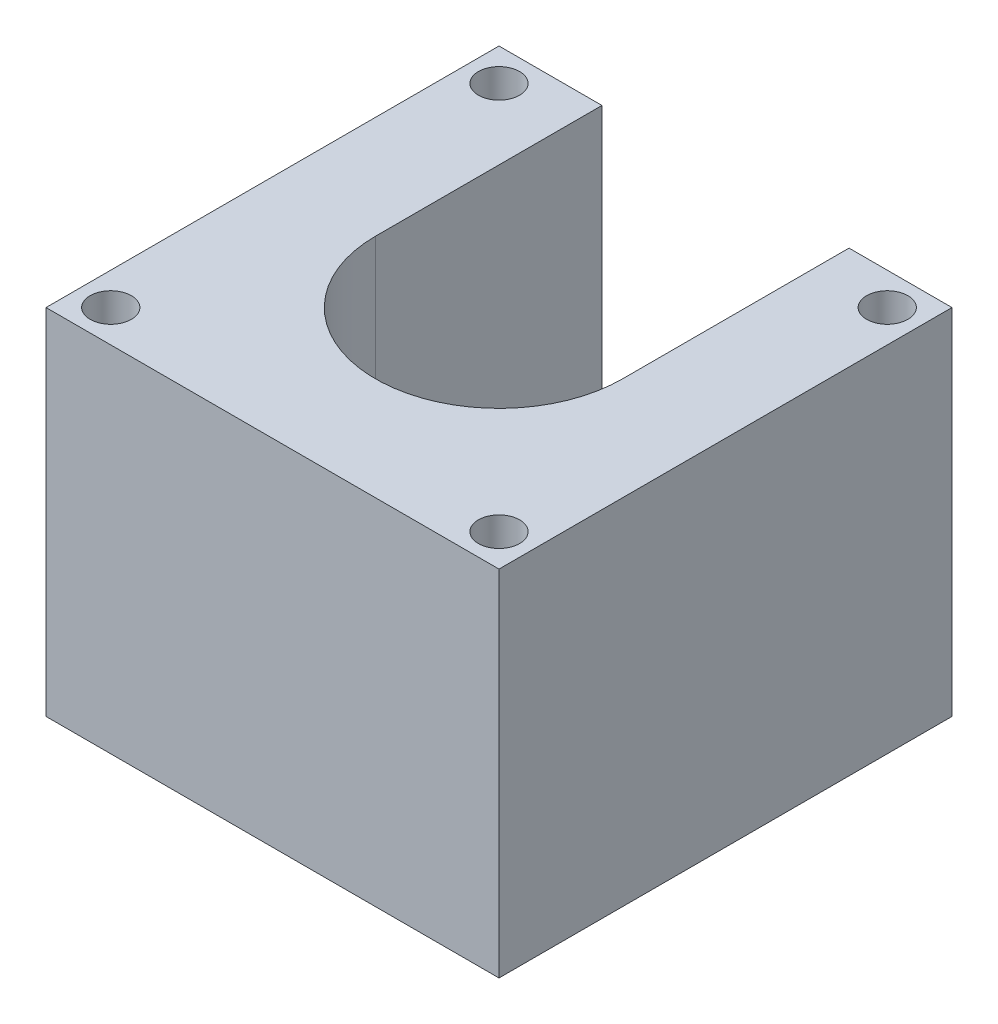
from build123d import *

# Parameters (mm, degrees)
SKETCH1_W           = 55
SKETCH1_H           = 55
SKETCH1_R           = 15
BOSS_EXTRUDE3_DEPTH = 9
BOSS_EXTRUDE4_DEPTH = 34
CUT_EXTRUDE1_REACH  = 60.644
SKETCH6_R           = 2.5


with BuildPart() as part:
    # Sketch1 → Boss-Extrude3 (new body)
    with BuildSketch(Plane(origin=(0, 0, 0), x_dir=(1, 0, 0), z_dir=(0, 1, 0))):
        with Locations((-0.141805914, 1.240284381)):
            Rectangle(SKETCH1_W, SKETCH1_H)
        with Locations(Location((-0.141805914, 1.240284381, 0), (0, 0, 270))):
            Circle(SKETCH1_R, mode=Mode.SUBTRACT)
    extrude(amount=BOSS_EXTRUDE3_DEPTH)

    # Sketch5 → Boss-Extrude4 (add)
    with BuildSketch(Plane(origin=(0, 9, 0), x_dir=(1, 0, 0), z_dir=(0, 1, 0))):
        with BuildLine():
            ThreePointArc((14.858194086, 1.240284381), (-0.141805914, -13.759715619), (-15.141805914, 1.240284381))
            Line((-15.141805914, 1.240284381), (-15.141805914, 28.740284381))
            Line((-15.141805914, 28.740284381), (-27.641805914, 28.740284381))
            Line((-27.641805914, 28.740284381), (-27.641805914, -26.259715619))
            Line((-27.641805914, -26.259715619), (27.358194086, -26.259715619))
            Line((27.358194086, -26.259715619), (27.358194086, 28.740284381))
            Line((27.358194086, 28.740284381), (14.858194086, 28.740284381))
            Line((14.858194086, 28.740284381), (14.858194086, 1.240284381))
        make_face()
    extrude(amount=BOSS_EXTRUDE4_DEPTH)

    # Sketch6 → Cut-Extrude1 (cut, up to next)
    with BuildSketch(Plane.XZ, mode=Mode.PRIVATE) as cut_extrude1_sk1:
        with Locations(Location((-23.711805914, 22.329715619, 0), (0, 0, 270))):
            Circle(SKETCH6_R)
    cut_extrude1_tool1 = extrude(cut_extrude1_sk1.sketch, amount=-CUT_EXTRUDE1_REACH, mode=Mode.PRIVATE) & part.part
    # Sketch6 → Cut-Extrude1 (cut, up to next)
    with BuildSketch(Plane.XZ, mode=Mode.PRIVATE) as cut_extrude1_sk2:
        with Locations(Location((23.428194086, 22.329715619, 0), (0, 0, 270))):
            Circle(SKETCH6_R)
    cut_extrude1_tool2 = extrude(cut_extrude1_sk2.sketch, amount=-CUT_EXTRUDE1_REACH, mode=Mode.PRIVATE) & part.part
    # Sketch6 → Cut-Extrude1 (cut, up to next)
    with BuildSketch(Plane.XZ, mode=Mode.PRIVATE) as cut_extrude1_sk3:
        with Locations(Location((-23.711805914, -24.810284381, 0), (0, 0, 270))):
            Circle(SKETCH6_R)
    cut_extrude1_tool3 = extrude(cut_extrude1_sk3.sketch, amount=-CUT_EXTRUDE1_REACH, mode=Mode.PRIVATE) & part.part
    # Sketch6 → Cut-Extrude1 (cut, up to next)
    with BuildSketch(Plane.XZ, mode=Mode.PRIVATE) as cut_extrude1_sk4:
        with Locations(Location((23.428194086, -24.810284381, 0), (0, 0, 270))):
            Circle(SKETCH6_R)
    cut_extrude1_tool4 = extrude(cut_extrude1_sk4.sketch, amount=-CUT_EXTRUDE1_REACH, mode=Mode.PRIVATE) & part.part
    add(cut_extrude1_tool1.solids().sort_by_distance((-23.711806, 0, 22.329716))[0], mode=Mode.SUBTRACT)
    add(cut_extrude1_tool2.solids().sort_by_distance((23.428194, 0, 22.329716))[0], mode=Mode.SUBTRACT)
    add(cut_extrude1_tool3.solids().sort_by_distance((-23.711806, 0, -24.810284))[0], mode=Mode.SUBTRACT)
    add(cut_extrude1_tool4.solids().sort_by_distance((23.428194, 0, -24.810284))[0], mode=Mode.SUBTRACT)


solid = part.part
